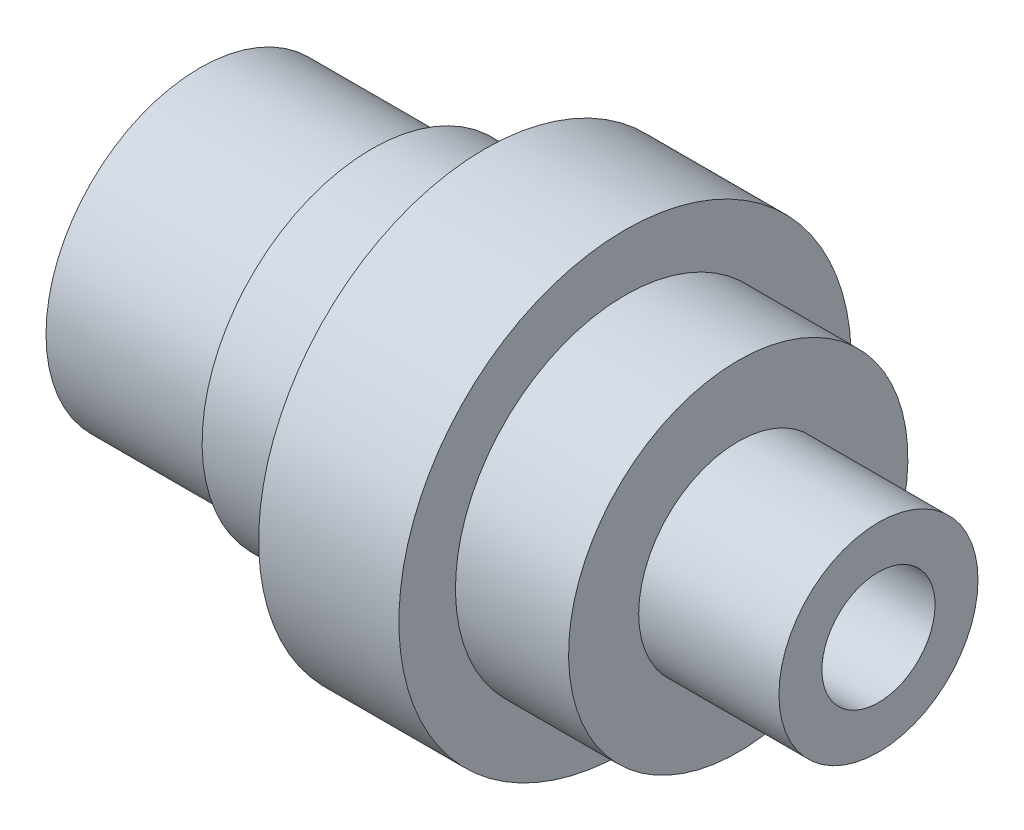
from build123d import *


with BuildPart() as part:
    # Sketch1 → Revolve1 (revolve)
    with BuildSketch(Plane.XY):
        Polygon((0, 8.636), (0, 3.175), (38.1, 3.175), (38.1, 5.588), (30.226, 5.588), (30.226, 9.525), (23.876, 9.525), (23.876, 12.7), (16.002, 12.7), (16.002, 9.525), (9.652, 9.525), (9.652, 8.636), align=None)
    revolve(axis=Axis((38.1, 0, 0), (-1, 0, 0)))


solid = part.part
